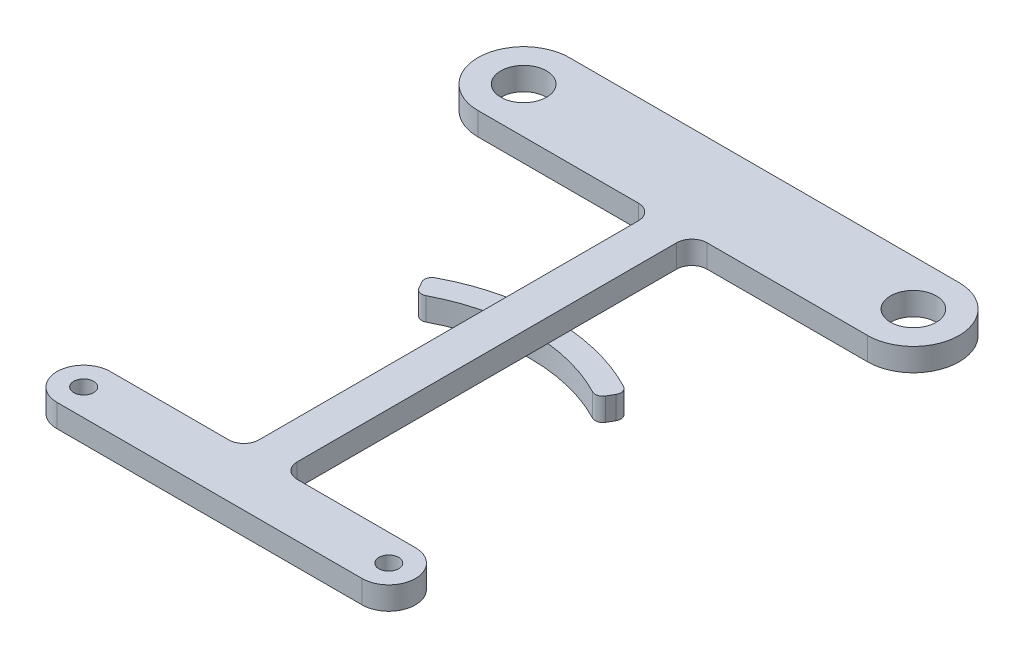
from build123d import *

# Parameters (mm, degrees)
SKETCH1_R           = 1.3
SKETCH1_R_2         = 3
BOSS_EXTRUDE4_DEPTH = 3
BOSS_EXTRUDE5_DEPTH = 3
FILLET4_R           = 1
FILLET5_R           = 2


with BuildPart() as part:
    # Sketch1 → Boss-Extrude4 (new body)
    with BuildSketch(Plane(origin=(0, 0, 0), x_dir=(1, 0, 0), z_dir=(0, 1, 0))):
        with BuildLine():
            Line((-25.55, 54.240000374), (25.55, 54.240000374))
            ThreePointArc((25.55, 54.240000374), (31.550000374, 48.24), (25.55, 42.239999626))
            Line((25.55, 42.239999626), (2.5, 42.239999626))
            Line((2.5, 42.239999626), (2.5, -11.500002156))
            Line((2.5, -11.500002156), (20, -11.500003832))
            ThreePointArc((20, -11.500003832), (23.499996168, -15), (20, -18.499996168))
            Line((20, -18.499996168), (-20, -18.5))
            ThreePointArc((-20, -18.5), (-23.5, -15), (-20, -11.5))
            Line((-20, -11.5), (-2.5, -11.500001677))
            Line((-2.5, -11.500001677), (-2.5, 42.239999626))
            Line((-2.5, 42.239999626), (-25.55, 42.239999626))
            ThreePointArc((-25.55, 42.239999626), (-31.550000374, 48.24), (-25.55, 54.240000374))
        make_face()
        with Locations(Location((-20, -15, 0), (0, 0, 270))):
            Circle(SKETCH1_R, mode=Mode.SUBTRACT)
        with Locations(Location((20, -15, 0), (0, 0, 270))):
            Circle(SKETCH1_R, mode=Mode.SUBTRACT)
        with Locations(Location((25.55, 48.24, 0), (0, 0, 270))):
            Circle(SKETCH1_R_2, mode=Mode.SUBTRACT)
        with Locations(Location((-25.55, 48.24, 0), (0, 0, 270))):
            Circle(SKETCH1_R_2, mode=Mode.SUBTRACT)
    extrude(amount=BOSS_EXTRUDE4_DEPTH)

    # Sketch2 → Boss-Extrude5 (add)
    with BuildSketch(Plane(origin=(0, 0, 0), x_dir=(1, 0, 0), z_dir=(0, 1, 0))):
        with BuildLine():
            Line((-11.75, 20.351596989), (-13.25, 22.9496732))
            ThreePointArc((-13.25, 22.9496732), (0, 26.5), (13.25, 22.9496732))
            Line((13.25, 22.9496732), (11.75, 20.351596989))
            ThreePointArc((11.75, 20.351596989), (0, 23.5), (-11.75, 20.351596989))
        make_face()
    extrude(amount=-BOSS_EXTRUDE5_DEPTH)

    # Fillet4
    fillet4_edges = [part.edges().sort_by_distance(p)[0] for p in [
        (-13.25, -1.5, -22.9496732),
        (13.25, -1.5, -22.9496732),
        (11.75, -1.5, -20.351596989),
        (-11.75, -1.5, -20.351596989),
    ]]
    fillet(fillet4_edges, radius=FILLET4_R)

    # Fillet5
    fillet5_edges = [part.edges().sort_by_distance(p)[0] for p in [
        (-2.5, 1.5, 11.500001677),
        (-2.5, 1.5, -42.239999626),
        (2.5, 1.5, -42.239999626),
        (2.5, 1.5, 11.500002156),
    ]]
    fillet(fillet5_edges, radius=FILLET5_R)


solid = part.part
